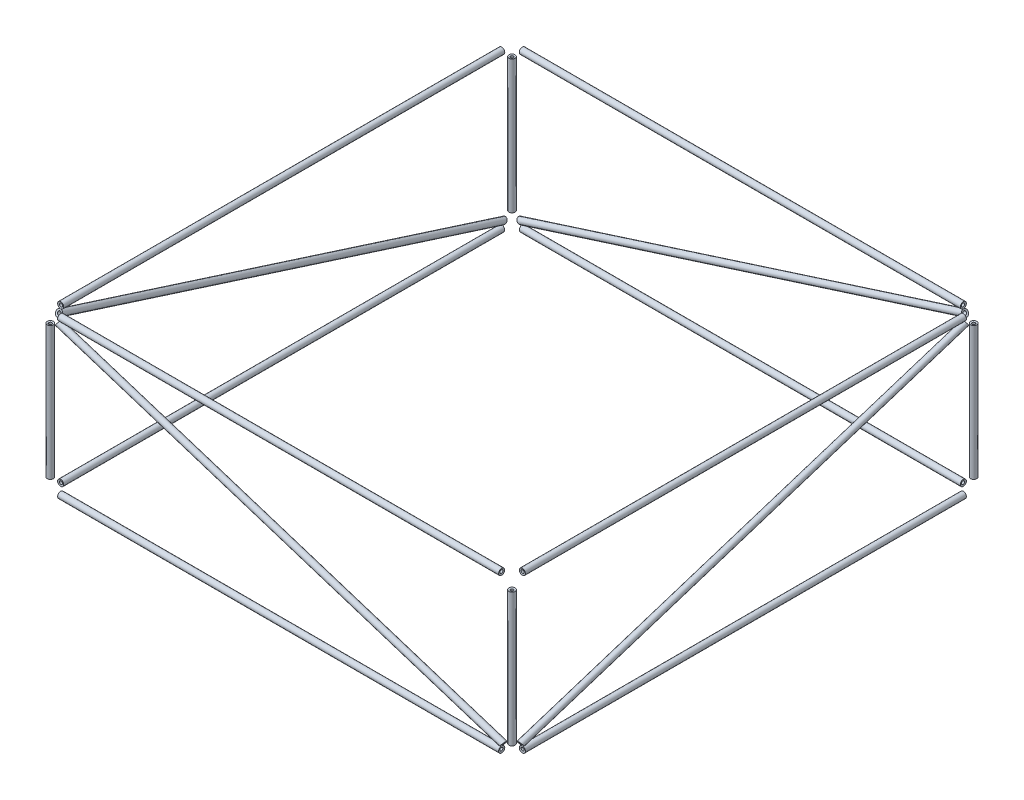
from build123d import *

# Parameters (mm, degrees)
SKETCH1_R                 = 2
SKETCH1_R_2               = 1
MEMBER_4_X_1_1_DEPTH      = 300
SKETCH1_ON_SEGMENT_2_R    = 2
SKETCH1_ON_SEGMENT_2_R_2  = 1
MEMBER_4_X_1_1_2_DEPTH    = 300
SKETCH1_ON_SEGMENT_3_R    = 2
SKETCH1_ON_SEGMENT_3_R_2  = 1
MEMBER_4_X_1_1_3_DEPTH    = 300
SKETCH1_ON_SEGMENT_4_R    = 2
SKETCH1_ON_SEGMENT_4_R_2  = 1
MEMBER_4_X_1_1_4_DEPTH    = 300
SKETCH1_ON_SEGMENT_5_R    = 2
SKETCH1_ON_SEGMENT_5_R_2  = 1
MEMBER_4_X_1_1_5_DEPTH    = 300
SKETCH1_ON_SEGMENT_6_R    = 2
SKETCH1_ON_SEGMENT_6_R_2  = 1
MEMBER_4_X_1_1_6_DEPTH    = 300
SKETCH1_ON_SEGMENT_7_R    = 2
SKETCH1_ON_SEGMENT_7_R_2  = 1
MEMBER_4_X_1_1_7_DEPTH    = 300
SKETCH1_ON_SEGMENT_8_R    = 2
SKETCH1_ON_SEGMENT_8_R_2  = 1
MEMBER_4_X_1_1_8_DEPTH    = 300
SKETCH1_ON_SEGMENT_9_R    = 2
SKETCH1_ON_SEGMENT_9_R_2  = 1
MEMBER_4_X_1_1_9_DEPTH    = 100
SKETCH1_ON_SEGMENT_10_R   = 2
SKETCH1_ON_SEGMENT_10_R_2 = 1
MEMBER_4_X_1_1_10_DEPTH   = 100
SKETCH1_ON_SEGMENT_11_R   = 2
SKETCH1_ON_SEGMENT_11_R_2 = 1
MEMBER_4_X_1_1_11_DEPTH   = 100
SKETCH1_ON_SEGMENT_12_R   = 2
SKETCH1_ON_SEGMENT_12_R_2 = 1
MEMBER_4_X_1_1_12_DEPTH   = 100
SKETCH1_ON_SEGMENT_13_R   = 2
SKETCH1_ON_SEGMENT_13_R_2 = 1
MEMBER_4_X_1_1_13_DEPTH   = 314.985713962
SKETCH1_ON_SEGMENT_14_R   = 2
SKETCH1_ON_SEGMENT_14_R_2 = 1
MEMBER_4_X_1_1_14_DEPTH   = 314.985713962
SKETCH1_ON_SEGMENT_15_R   = 2
SKETCH1_ON_SEGMENT_15_R_2 = 1
MEMBER_4_X_1_1_15_DEPTH   = 314.985713962
SKETCH1_ON_SEGMENT_16_R   = 2
SKETCH1_ON_SEGMENT_16_R_2 = 1
MEMBER_4_X_1_1_16_DEPTH   = 314.985713962


with BuildPart() as part:
    # Sketch1 → Member 4 X 1_1 (new body)
    with BuildSketch(Plane(origin=(149.99999999999997, 100.00000000000001, -150.00000000000003), x_dir=(0, -9e-17, 1), z_dir=(-1, -9e-17, 0))):
        Circle(SKETCH1_R)
        Circle(SKETCH1_R_2, mode=Mode.SUBTRACT)
    extrude(amount=MEMBER_4_X_1_1_DEPTH)


with BuildPart() as body_2:
    # Sketch1 on segment 2 (carried to segment 2) → Member 4 X 1_1 2 (new body)
    with BuildSketch(Plane(origin=(-150, 100, -150), x_dir=(1, 0, 0), z_dir=(0, 0, 1))):
        Circle(SKETCH1_ON_SEGMENT_2_R)
        Circle(SKETCH1_ON_SEGMENT_2_R_2, mode=Mode.SUBTRACT)
    extrude(amount=MEMBER_4_X_1_1_2_DEPTH)


with BuildPart() as body_3:
    # Sketch1 on segment 3 (carried to segment 3) → Member 4 X 1_1 3 (new body)
    with BuildSketch(Plane(origin=(-150, 100, 150), x_dir=(0, 0, -1), z_dir=(1, 0, 0))):
        Circle(SKETCH1_ON_SEGMENT_3_R)
        Circle(SKETCH1_ON_SEGMENT_3_R_2, mode=Mode.SUBTRACT)
    extrude(amount=MEMBER_4_X_1_1_3_DEPTH)


with BuildPart() as body_4:
    # Sketch1 on segment 4 (carried to segment 4) → Member 4 X 1_1 4 (new body)
    with BuildSketch(Plane(origin=(150, 100, 150), x_dir=(-1, 0, 0), z_dir=(0, 0, -1))):
        Circle(SKETCH1_ON_SEGMENT_4_R)
        Circle(SKETCH1_ON_SEGMENT_4_R_2, mode=Mode.SUBTRACT)
    extrude(amount=MEMBER_4_X_1_1_4_DEPTH)


with BuildPart() as body_5:
    # Sketch1 on segment 5 (carried to segment 5) → Member 4 X 1_1 5 (new body)
    with BuildSketch(Plane(origin=(-150, 0, -150), x_dir=(1, 0, 0), z_dir=(0, 0, 1))):
        Circle(SKETCH1_ON_SEGMENT_5_R)
        Circle(SKETCH1_ON_SEGMENT_5_R_2, mode=Mode.SUBTRACT)
    extrude(amount=MEMBER_4_X_1_1_5_DEPTH)


with BuildPart() as body_6:
    # Sketch1 on segment 6 (carried to segment 6) → Member 4 X 1_1 6 (new body)
    with BuildSketch(Plane(origin=(-150, 0, 150), x_dir=(0, 0, -1), z_dir=(1, 0, 0))):
        Circle(SKETCH1_ON_SEGMENT_6_R)
        Circle(SKETCH1_ON_SEGMENT_6_R_2, mode=Mode.SUBTRACT)
    extrude(amount=MEMBER_4_X_1_1_6_DEPTH)


with BuildPart() as body_7:
    # Sketch1 on segment 7 (carried to segment 7) → Member 4 X 1_1 7 (new body)
    with BuildSketch(Plane(origin=(150, 0, 150), x_dir=(-1, 0, 0), z_dir=(0, 0, -1))):
        Circle(SKETCH1_ON_SEGMENT_7_R)
        Circle(SKETCH1_ON_SEGMENT_7_R_2, mode=Mode.SUBTRACT)
    extrude(amount=MEMBER_4_X_1_1_7_DEPTH)


with BuildPart() as body_8:
    # Sketch1 on segment 8 (carried to segment 8) → Member 4 X 1_1 8 (new body)
    with BuildSketch(Plane(origin=(150, 0, -150), x_dir=(0, 0, 1), z_dir=(-1, 0, 0))):
        Circle(SKETCH1_ON_SEGMENT_8_R)
        Circle(SKETCH1_ON_SEGMENT_8_R_2, mode=Mode.SUBTRACT)
    extrude(amount=MEMBER_4_X_1_1_8_DEPTH)


with BuildPart() as body_9:
    # Sketch1 on segment 9 (carried to segment 9) → Member 4 X 1_1 9 (new body)
    with BuildSketch(Plane(origin=(-150, 0, -150), x_dir=(0, 0, 1), z_dir=(0, 1, 0))):
        Circle(SKETCH1_ON_SEGMENT_9_R)
        Circle(SKETCH1_ON_SEGMENT_9_R_2, mode=Mode.SUBTRACT)
    extrude(amount=MEMBER_4_X_1_1_9_DEPTH)


with BuildPart() as body_10:
    # Sketch1 on segment 10 (carried to segment 10) → Member 4 X 1_1 10 (new body)
    with BuildSketch(Plane(origin=(-150, 0, 150), x_dir=(0, 0, 1), z_dir=(0, 1, 0))):
        Circle(SKETCH1_ON_SEGMENT_10_R)
        Circle(SKETCH1_ON_SEGMENT_10_R_2, mode=Mode.SUBTRACT)
    extrude(amount=MEMBER_4_X_1_1_10_DEPTH)


with BuildPart() as body_11:
    # Sketch1 on segment 11 (carried to segment 11) → Member 4 X 1_1 11 (new body)
    with BuildSketch(Plane(origin=(150, 100, 150), x_dir=(0, 0, 1), z_dir=(0, -1, 0))):
        Circle(SKETCH1_ON_SEGMENT_11_R)
        Circle(SKETCH1_ON_SEGMENT_11_R_2, mode=Mode.SUBTRACT)
    extrude(amount=MEMBER_4_X_1_1_11_DEPTH)


with BuildPart() as body_12:
    # Sketch1 on segment 12 (carried to segment 12) → Member 4 X 1_1 12 (new body)
    with BuildSketch(Plane(origin=(150, 0, -150), x_dir=(0, 0, 1), z_dir=(0, 1, 0))):
        Circle(SKETCH1_ON_SEGMENT_12_R)
        Circle(SKETCH1_ON_SEGMENT_12_R_2, mode=Mode.SUBTRACT)
    extrude(amount=MEMBER_4_X_1_1_12_DEPTH)


with BuildPart() as body_13:
    # Sketch1 on segment 13 (carried to segment 13) → Member 4 X 1_1 13 (new body)
    with BuildSketch(Plane(origin=(150, 2, 150), x_dir=(0, 0, 1), z_dir=(-0.952424147, 0.304775727, 0))):
        Circle(SKETCH1_ON_SEGMENT_13_R)
        Circle(SKETCH1_ON_SEGMENT_13_R_2, mode=Mode.SUBTRACT)
    extrude(amount=MEMBER_4_X_1_1_13_DEPTH)


with BuildPart() as body_14:
    # Sketch1 on segment 14 (carried to segment 14) → Member 4 X 1_1 14 (new body)
    with BuildSketch(Plane(origin=(-150, 98, 150), x_dir=(-0.952424147, -0.290275762, 0.092888244), z_dir=(0, -0.304775727, -0.952424147))):
        Circle(SKETCH1_ON_SEGMENT_14_R)
        Circle(SKETCH1_ON_SEGMENT_14_R_2, mode=Mode.SUBTRACT)
    extrude(amount=MEMBER_4_X_1_1_14_DEPTH)


with BuildPart() as body_15:
    # Sketch1 on segment 15 (carried to segment 15) → Member 4 X 1_1 15 (new body)
    with BuildSketch(Plane(origin=(-150, 2, -150), x_dir=(0, 0, 1), z_dir=(0.952424147, 0.304775727, 0))):
        Circle(SKETCH1_ON_SEGMENT_15_R)
        Circle(SKETCH1_ON_SEGMENT_15_R_2, mode=Mode.SUBTRACT)
    extrude(amount=MEMBER_4_X_1_1_15_DEPTH)


with BuildPart() as body_16:
    # Sketch1 on segment 16 (carried to segment 16) → Member 4 X 1_1 16 (new body)
    with BuildSketch(Plane(origin=(150, 98, -150), x_dir=(0.952424147, 0.290275762, 0.092888244), z_dir=(0, -0.304775727, 0.952424147))):
        Circle(SKETCH1_ON_SEGMENT_16_R)
        Circle(SKETCH1_ON_SEGMENT_16_R_2, mode=Mode.SUBTRACT)
    extrude(amount=MEMBER_4_X_1_1_16_DEPTH)


with BuildPart() as cut_revolve_6_tool:
    # 草圖4 → 除料-旋轉6 (revolve)
    with BuildSketch(Plane(origin=(0, 0, 0), x_dir=(1, 0, 0), z_dir=(0, 1, 0))):
        with BuildLine():
            Line((150.00000000000003, -143), (150.00000000000003, -157))
            ThreePointArc((150.00000000000003, -157), (157.00000000000003, -150), (150.00000000000003, -143))
        make_face()
    revolve(axis=Axis((150.00000000000003, 0, 143), (0, 0, 1)))


with BuildPart() as body_6_1:
    add(body_6.part)

    # 除料-旋轉6: cut by cut_revolve_6_tool
    add(cut_revolve_6_tool.part, mode=Mode.SUBTRACT)


with BuildPart() as body_7_1:
    add(body_7.part)

    # 除料-旋轉6: cut by cut_revolve_6_tool
    add(cut_revolve_6_tool.part, mode=Mode.SUBTRACT)


with BuildPart() as body_11_1:
    add(body_11.part)

    # 除料-旋轉6: cut by cut_revolve_6_tool
    add(cut_revolve_6_tool.part, mode=Mode.SUBTRACT)


with BuildPart() as body_13_1:
    add(body_13.part)

    # 除料-旋轉6: cut by cut_revolve_6_tool
    add(cut_revolve_6_tool.part, mode=Mode.SUBTRACT)


with BuildPart() as body_16_1:
    add(body_16.part)

    # 除料-旋轉6: cut by cut_revolve_6_tool
    add(cut_revolve_6_tool.part, mode=Mode.SUBTRACT)


with BuildPart() as cut_revolve_7_tool:
    # 草圖5 → 除料-旋轉7 (revolve)
    with BuildSketch(Plane(origin=(0, 0, 0), x_dir=(1, 0, 0), z_dir=(0, 1, 0))):
        with BuildLine():
            Line((142.99999999999997, 149.99999999999997), (156.99999999999997, 149.99999999999997))
            ThreePointArc((156.99999999999997, 149.99999999999997), (149.99999999999997, 142.99999999999997), (142.99999999999997, 149.99999999999997))
        make_face()
    revolve(axis=Axis((142.99999999999997, 0, -149.99999999999997), (1, 0, 0)))


with BuildPart() as body_7_2:
    add(body_7_1.part)

    # 除料-旋轉7: cut by cut_revolve_7_tool
    add(cut_revolve_7_tool.part, mode=Mode.SUBTRACT)


with BuildPart() as body_8_1:
    add(body_8.part)

    # 除料-旋轉7: cut by cut_revolve_7_tool
    add(cut_revolve_7_tool.part, mode=Mode.SUBTRACT)


with BuildPart() as body_12_1:
    add(body_12.part)

    # 除料-旋轉7: cut by cut_revolve_7_tool
    add(cut_revolve_7_tool.part, mode=Mode.SUBTRACT)


with BuildPart() as cut_revolve_8_tool:
    # 草圖6 → 除料-旋轉8 (revolve)
    with BuildSketch(Plane(origin=(-9.25e-15, 99.99999999999996, 2.776e-14), x_dir=(-1, -9e-17, 0), z_dir=(9e-17, -1, -2.8e-16))):
        with BuildLine():
            Line((-142.99999999999997, 150.00000000000006), (-156.99999999999997, 150.00000000000006))
            ThreePointArc((-156.99999999999997, 150.00000000000006), (-149.99999999999997, 143.00000000000006), (-142.99999999999997, 150.00000000000006))
        make_face()
    revolve(axis=Axis((142.99999999999997, 100.00000000000001, -150.00000000000003), (1, 0, 0)))


with BuildPart() as part_1:
    add(part.part)

    # 除料-旋轉8: cut by cut_revolve_8_tool
    add(cut_revolve_8_tool.part, mode=Mode.SUBTRACT)


with BuildPart() as body_4_1:
    add(body_4.part)

    # 除料-旋轉8: cut by cut_revolve_8_tool
    add(cut_revolve_8_tool.part, mode=Mode.SUBTRACT)


with BuildPart() as body_12_2:
    add(body_12_1.part)

    # 除料-旋轉8: cut by cut_revolve_8_tool
    add(cut_revolve_8_tool.part, mode=Mode.SUBTRACT)


with BuildPart() as body_15_1:
    add(body_15.part)

    # 除料-旋轉8: cut by cut_revolve_8_tool
    add(cut_revolve_8_tool.part, mode=Mode.SUBTRACT)


with BuildPart() as body_16_2:
    add(body_16_1.part)

    # 除料-旋轉8: cut by cut_revolve_8_tool
    add(cut_revolve_8_tool.part, mode=Mode.SUBTRACT)


with BuildPart() as cut_revolve_9_tool:
    # 草圖7 → 除料-旋轉9 (revolve)
    with BuildSketch(Plane(origin=(-9.25e-15, 99.99999999999996, 2.776e-14), x_dir=(-1, -9e-17, 0), z_dir=(9e-17, -1, -2.8e-16))):
        with BuildLine():
            Line((-143.00000000000006, -149.99999999999994), (-157.00000000000006, -149.99999999999994))
            ThreePointArc((-157.00000000000006, -149.99999999999994), (-150.00000000000006, -143), (-143.00000000000006, -149.99999999999994))
        make_face()
    revolve(axis=Axis((143.00000000000006, 99.99999999999994, 149.99999999999997), (1, 0, 0)))


with BuildPart() as body_3_1:
    add(body_3.part)

    # 除料-旋轉9: cut by cut_revolve_9_tool
    add(cut_revolve_9_tool.part, mode=Mode.SUBTRACT)


with BuildPart() as body_4_2:
    add(body_4_1.part)

    # 除料-旋轉9: cut by cut_revolve_9_tool
    add(cut_revolve_9_tool.part, mode=Mode.SUBTRACT)


with BuildPart() as body_11_2:
    add(body_11_1.part)

    # 除料-旋轉9: cut by cut_revolve_9_tool
    add(cut_revolve_9_tool.part, mode=Mode.SUBTRACT)


with BuildPart() as cut_revolve_10_tool:
    # 草圖8 → 除料-旋轉10 (revolve)
    with BuildSketch(Plane(origin=(0, 0, 0), x_dir=(1, 0, 0), z_dir=(0, 1, 0))):
        with BuildLine():
            Line((-150, -156.99999999999997), (-150, -142.99999999999997))
            ThreePointArc((-150, -142.99999999999997), (-143, -149.99999999999997), (-150, -156.99999999999997))
        make_face()
    revolve(axis=Axis((-150, 0, 156.99999999999997), (0, 0, -1)))


with BuildPart() as body_5_1:
    add(body_5.part)

    # 除料-旋轉10: cut by cut_revolve_10_tool
    add(cut_revolve_10_tool.part, mode=Mode.SUBTRACT)


with BuildPart() as body_6_2:
    add(body_6_1.part)

    # 除料-旋轉10: cut by cut_revolve_10_tool
    add(cut_revolve_10_tool.part, mode=Mode.SUBTRACT)


with BuildPart() as body_10_1:
    add(body_10.part)

    # 除料-旋轉10: cut by cut_revolve_10_tool
    add(cut_revolve_10_tool.part, mode=Mode.SUBTRACT)


with BuildPart() as cut_revolve_11_tool:
    # 草圖9 → 除料-旋轉11 (revolve)
    with BuildSketch(Plane(origin=(0, 0, 0), x_dir=(1, 0, 0), z_dir=(0, 1, 0))):
        with BuildLine():
            Line((-142.99999999999997, 149.99999999999997), (-156.99999999999997, 149.99999999999997))
            ThreePointArc((-156.99999999999997, 149.99999999999997), (-149.99999999999997, 157.00000000000003), (-142.99999999999997, 149.99999999999997))
        make_face()
    revolve(axis=Axis((-142.99999999999997, 0, -149.99999999999997), (-1, 0, 0)))


with BuildPart() as body_5_2:
    add(body_5_1.part)

    # 除料-旋轉11: cut by cut_revolve_11_tool
    add(cut_revolve_11_tool.part, mode=Mode.SUBTRACT)


with BuildPart() as body_8_2:
    add(body_8_1.part)

    # 除料-旋轉11: cut by cut_revolve_11_tool
    add(cut_revolve_11_tool.part, mode=Mode.SUBTRACT)


with BuildPart() as body_9_1:
    add(body_9.part)

    # 除料-旋轉11: cut by cut_revolve_11_tool
    add(cut_revolve_11_tool.part, mode=Mode.SUBTRACT)


with BuildPart() as body_14_1:
    add(body_14.part)

    # 除料-旋轉11: cut by cut_revolve_11_tool
    add(cut_revolve_11_tool.part, mode=Mode.SUBTRACT)


with BuildPart() as body_15_2:
    add(body_15_1.part)

    # 除料-旋轉11: cut by cut_revolve_11_tool
    add(cut_revolve_11_tool.part, mode=Mode.SUBTRACT)


with BuildPart() as cut_revolve_12_tool:
    # 草圖10 → 除料-旋轉12 (revolve)
    with BuildSketch(Plane(origin=(-9.25e-15, 99.99999999999996, 2.776e-14), x_dir=(-1, -9e-17, 0), z_dir=(9e-17, -1, -2.8e-16))):
        with BuildLine():
            Line((143, -149.99999999999994), (157, -149.99999999999994))
            ThreePointArc((157, -149.99999999999994), (150, -156.99999999999994), (143, -149.99999999999994))
        make_face()
    revolve(axis=Axis((-143, 99.99999999999991, 149.99999999999997), (-1, 0, 0)))


with BuildPart() as body_2_1:
    add(body_2.part)

    # 除料-旋轉12: cut by cut_revolve_12_tool
    add(cut_revolve_12_tool.part, mode=Mode.SUBTRACT)


with BuildPart() as body_3_2:
    add(body_3_1.part)

    # 除料-旋轉12: cut by cut_revolve_12_tool
    add(cut_revolve_12_tool.part, mode=Mode.SUBTRACT)


with BuildPart() as body_10_2:
    add(body_10_1.part)

    # 除料-旋轉12: cut by cut_revolve_12_tool
    add(cut_revolve_12_tool.part, mode=Mode.SUBTRACT)


with BuildPart() as body_13_2:
    add(body_13_1.part)

    # 除料-旋轉12: cut by cut_revolve_12_tool
    add(cut_revolve_12_tool.part, mode=Mode.SUBTRACT)


with BuildPart() as body_14_2:
    add(body_14_1.part)

    # 除料-旋轉12: cut by cut_revolve_12_tool
    add(cut_revolve_12_tool.part, mode=Mode.SUBTRACT)


with BuildPart() as cut_revolve_13_tool:
    # 草圖11 → 除料-旋轉13 (revolve)
    with BuildSketch(Plane(origin=(-9.25e-15, 99.99999999999996, 2.776e-14), x_dir=(-1, -9e-17, 0), z_dir=(9e-17, -1, -2.8e-16))):
        with BuildLine():
            Line((142.99999999999997, 150.00000000000006), (156.99999999999997, 150.00000000000006))
            ThreePointArc((156.99999999999997, 150.00000000000006), (149.99999999999997, 143.00000000000006), (142.99999999999997, 150.00000000000006))
        make_face()
    revolve(axis=Axis((-142.99999999999997, 99.99999999999999, -150.00000000000003), (-1, 0, 0)))


with BuildPart() as part_2:
    add(part_1.part)

    # 除料-旋轉13: cut by cut_revolve_13_tool
    add(cut_revolve_13_tool.part, mode=Mode.SUBTRACT)


with BuildPart() as body_2_2:
    add(body_2_1.part)

    # 除料-旋轉13: cut by cut_revolve_13_tool
    add(cut_revolve_13_tool.part, mode=Mode.SUBTRACT)


with BuildPart() as body_9_2:
    add(body_9_1.part)

    # 除料-旋轉13: cut by cut_revolve_13_tool
    add(cut_revolve_13_tool.part, mode=Mode.SUBTRACT)


solid = Compound([body_7_2.part, body_12_2.part, body_16_2.part, body_4_2.part, body_11_2.part, body_6_2.part, body_5_2.part, body_8_2.part, body_15_2.part, body_3_2.part, body_10_2.part, body_13_2.part, body_14_2.part, part_2.part, body_2_2.part, body_9_2.part])
